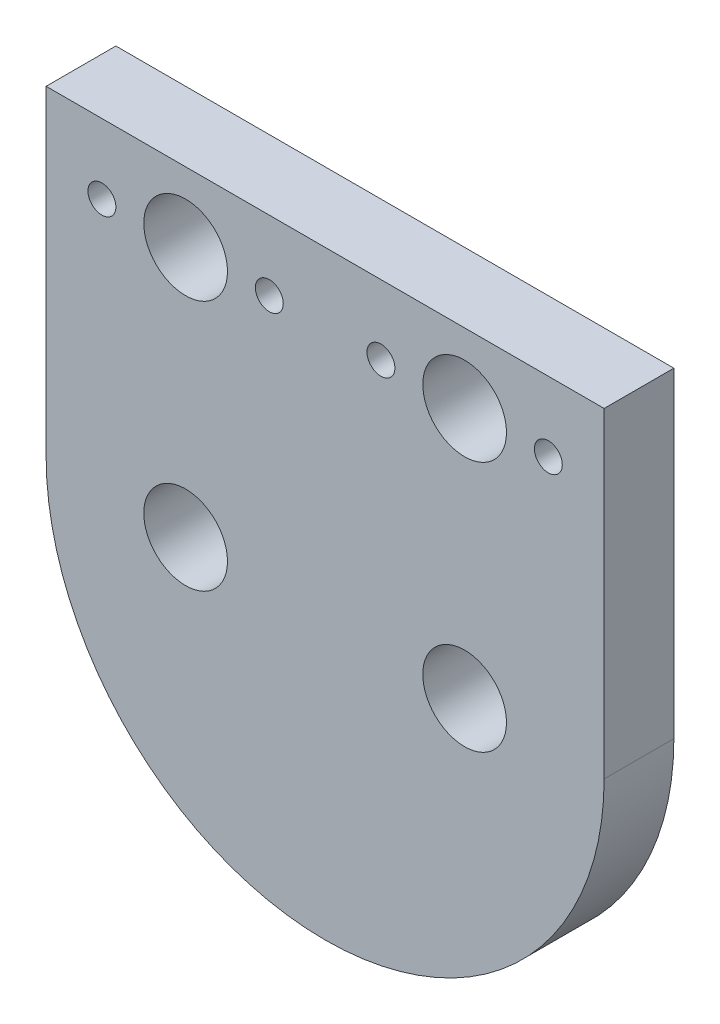
from build123d import *

# Parameters (mm, degrees)
CROQUIS1_R              = 3
CROQUIS1_R_2            = 1
SALIENTE_EXTRUIR1_DEPTH = 5


with BuildPart() as part:
    # Croquis1 → Saliente-Extruir1 (new body)
    with BuildSketch(Plane.XY):
        with BuildLine():
            Line((-20, 0), (-20, 23))
            Line((-20, 23), (20, 23))
            Line((20, 23), (20, 0))
            ThreePointArc((20, 0), (0, -20), (-20, 0))
        make_face()
        with Locations((10, 0)):
            Circle(CROQUIS1_R, mode=Mode.SUBTRACT)
        with Locations((-10, 0)):
            Circle(CROQUIS1_R, mode=Mode.SUBTRACT)
        with Locations((-10, 18)):
            Circle(CROQUIS1_R, mode=Mode.SUBTRACT)
        with Locations((10, 18)):
            Circle(CROQUIS1_R, mode=Mode.SUBTRACT)
        with Locations((-4, 18)):
            Circle(CROQUIS1_R_2, mode=Mode.SUBTRACT)
        with Locations((-16, 18)):
            Circle(CROQUIS1_R_2, mode=Mode.SUBTRACT)
        with Locations((4, 18)):
            Circle(CROQUIS1_R_2, mode=Mode.SUBTRACT)
        with Locations((16, 18)):
            Circle(CROQUIS1_R_2, mode=Mode.SUBTRACT)
    extrude(amount=SALIENTE_EXTRUIR1_DEPTH)


solid = part.part
